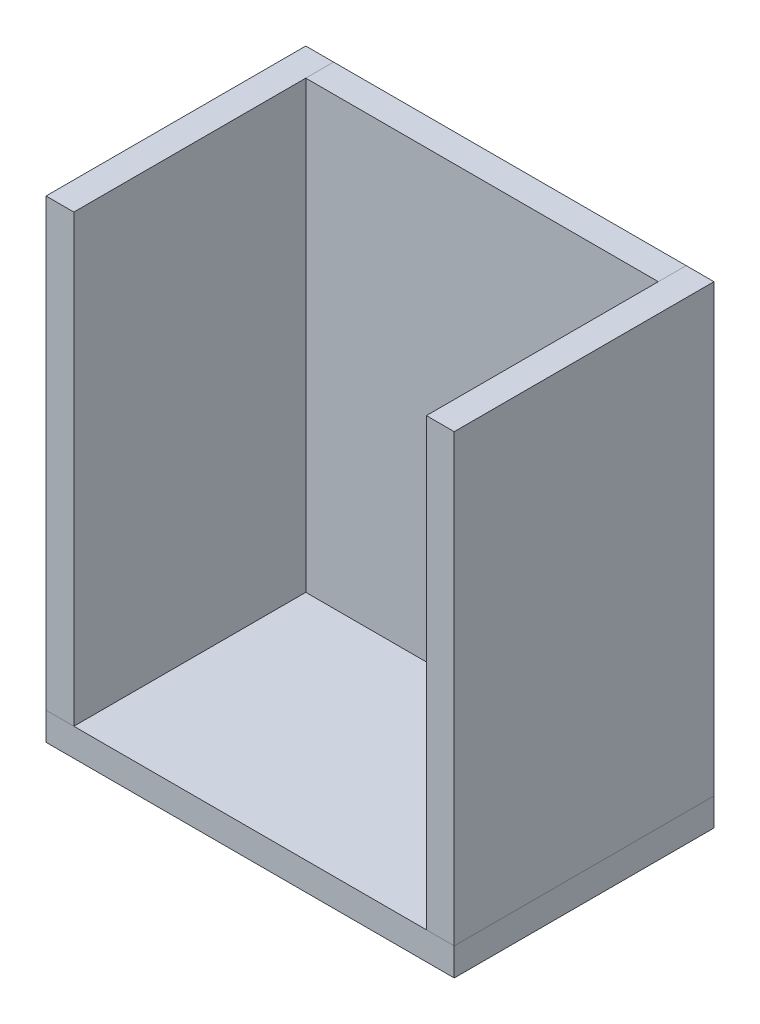
from build123d import *

# Parameters (mm, degrees)
SKETCH1_W             = 279.4
SKETCH1_H             = 177.8
BOSS_EXTRUDE1_DEPTH   = 19.05
BOSS_EXTRUDE2_DEPTH   = 304.8
BOSS_EXTRUDE2_2_DEPTH = 304.8
SKETCH2_3_W           = 241.3
SKETCH2_3_H           = 19.05
BOSS_EXTRUDE3_DEPTH   = 304.8


with BuildPart() as part:
    # Sketch1 → Boss-Extrude1 (new body)
    with BuildSketch(Plane(origin=(0, 0, 0), x_dir=(1, 0, 0), z_dir=(0, 1, 0))):
        Rectangle(SKETCH1_W, SKETCH1_H)
    extrude(amount=BOSS_EXTRUDE1_DEPTH)


with BuildPart() as body_2:
    # Sketch2 → Boss-Extrude2 (new body)
    with BuildSketch(Plane(origin=(0, 19.05, 0), x_dir=(1, 0, 0), z_dir=(0, 1, 0))):
        Polygon((-120.65, 88.9), (-139.7, 88.9), (-139.7, -88.9), (-120.65, -88.9), (-120.65, 69.85), align=None)
    extrude(amount=BOSS_EXTRUDE2_DEPTH)


with BuildPart() as body_3:
    # Sketch2 → Boss-Extrude2 2 (new body)
    with BuildSketch(Plane(origin=(0, 19.05, 0), x_dir=(1, 0, 0), z_dir=(0, 1, 0))):
        Polygon((139.7, 88.9), (120.65, 88.9), (120.65, 69.85), (120.65, -88.9), (139.7, -88.9), align=None)
    extrude(amount=BOSS_EXTRUDE2_2_DEPTH)


with BuildPart() as body_4:
    # Sketch2<3> → Boss-Extrude3 (new body)
    with BuildSketch(Plane(origin=(0, 19.05, 0), x_dir=(1, 0, 0), z_dir=(0, 1, 0))):
        with Locations((0, 79.375)):
            Rectangle(SKETCH2_3_W, SKETCH2_3_H)
    extrude(amount=BOSS_EXTRUDE3_DEPTH)


solid = Compound([part.part, body_2.part, body_3.part, body_4.part])
